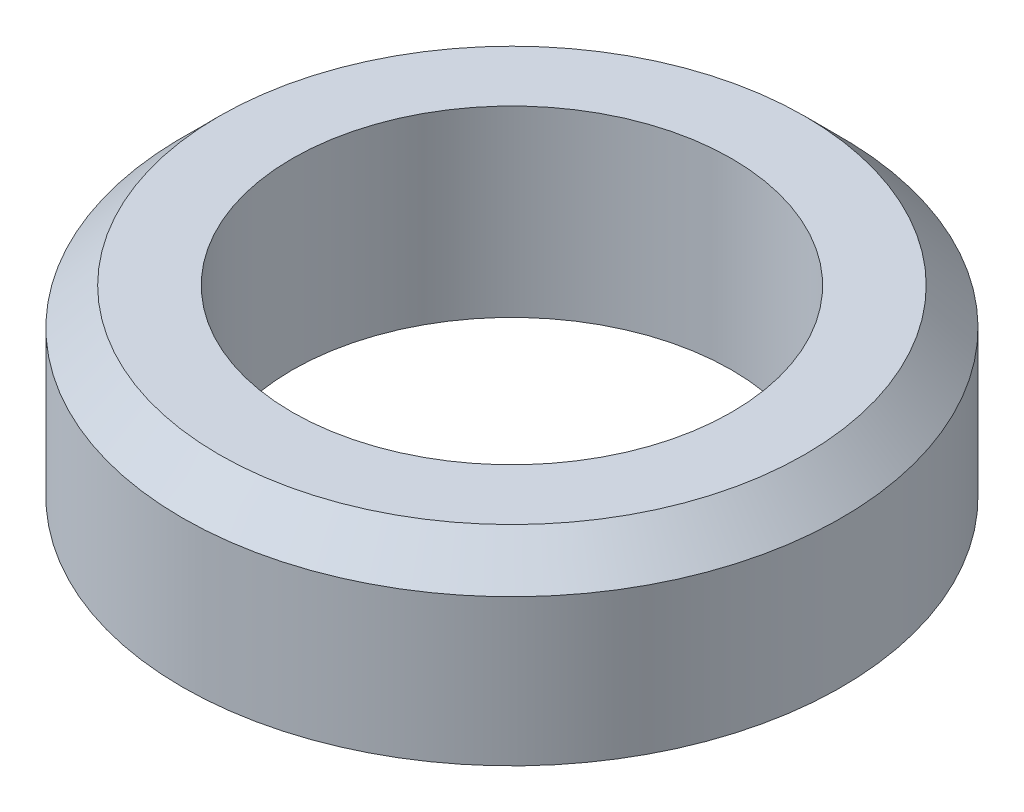
from build123d import *

# Parameters (mm, degrees)
SKETCH_1_R      = 4.5
SKETCH_1_R_2    = 3
EXTRUDE_1_DEPTH = 2.5
CHAMFER_1_SIZE  = 0.5


with BuildPart() as part:
    # Эскиз1 → Бобышка-Вытянуть1 (new body)
    with BuildSketch(Plane(origin=(0, 0, 0), x_dir=(1, 0, 0), z_dir=(0, 1, 0))):
        with Locations(Location((0, 0, 0), (0, 0, 270))):
            Circle(SKETCH_1_R)
        with Locations(Location((0, 0, 0), (0, 0, 270))):
            Circle(SKETCH_1_R_2, mode=Mode.SUBTRACT)
    extrude(amount=EXTRUDE_1_DEPTH)

    # Фаска1
    chamfer_1_edges = [part.edges().sort_by_distance(p)[0] for p in [
        (0, 2.5, -4.5),
    ]]
    chamfer(chamfer_1_edges, length=CHAMFER_1_SIZE)


solid = part.part
